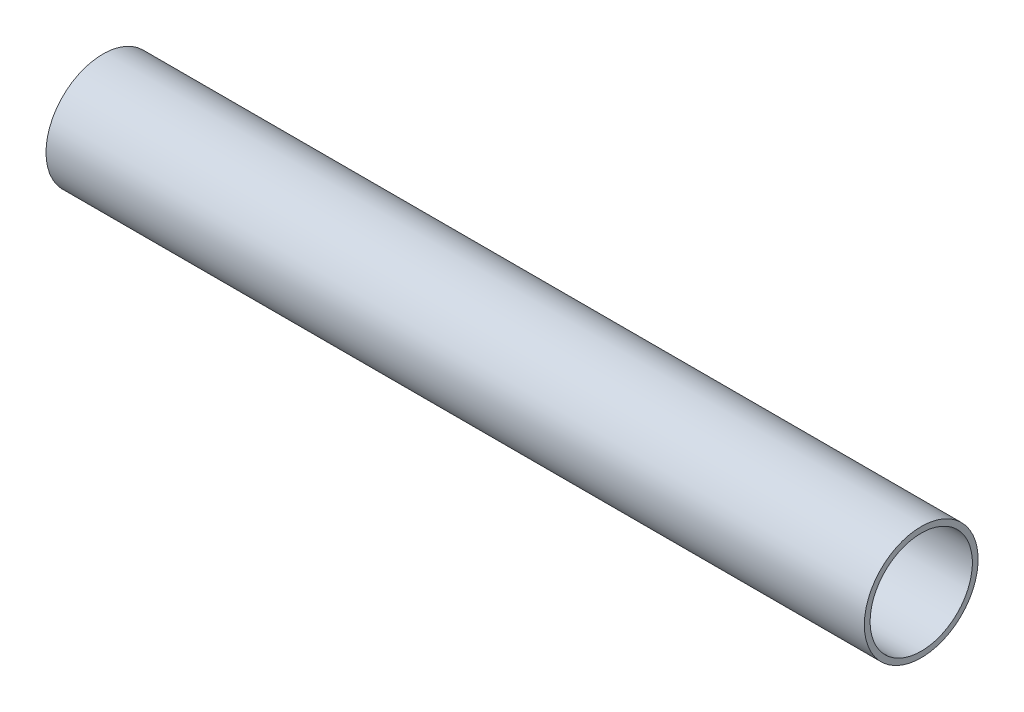
from build123d import *


with BuildPart() as part:
    # Sketch1 → Revolve1 (revolve)
    with BuildSketch(Plane.XY, mode=Mode.PRIVATE) as revolve1_sk:
        Polygon((0, 12.5), (98.862591781, 12.5), (98.862591781, 6.25), (100.862591781, 7.563907138), (100.862591781, 12.5), (200, 12.5), (200, 13.904009407), (0, 13.904009407), align=None)
    revolve(revolve1_sk.sketch.rotate(Axis((-93.574766355, 0, 0), (1, 0, 0)), 90), axis=Axis((-93.574766355, 0, 0), (1, 0, 0)))


solid = part.part
